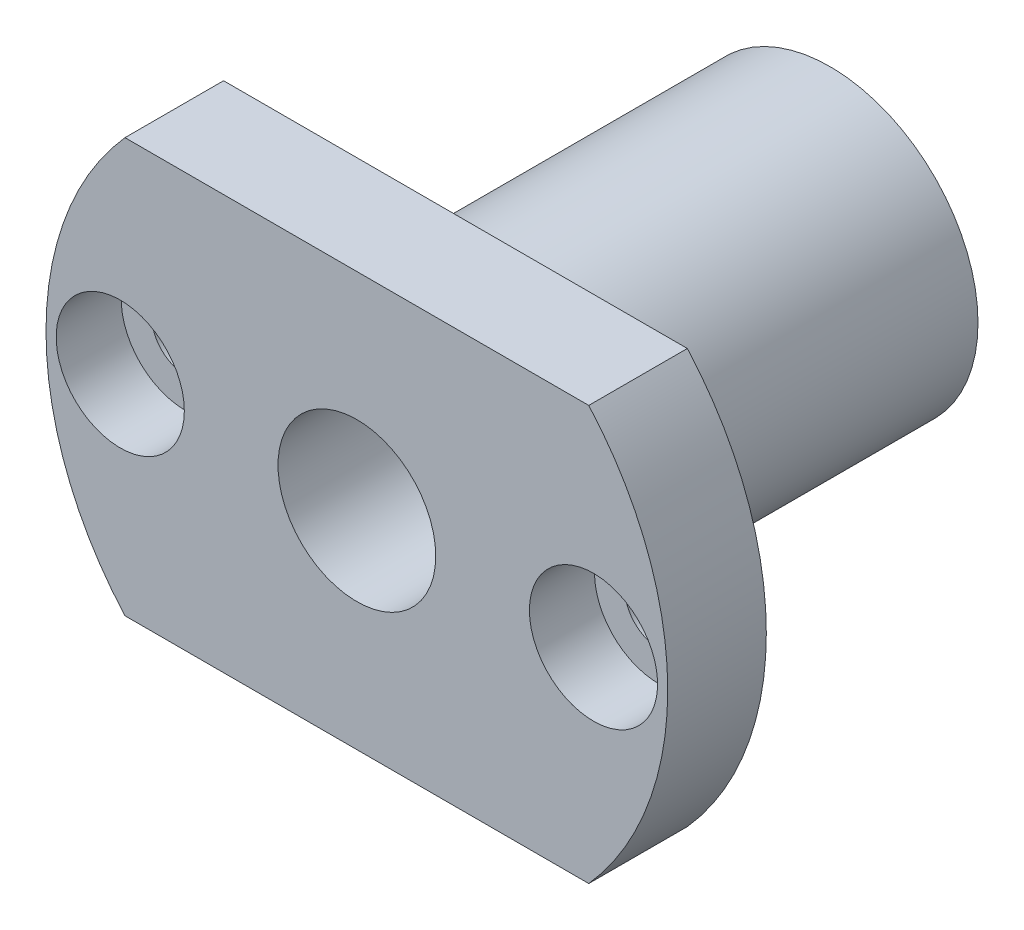
from build123d import *

# Parameters (mm, degrees)
SKETCH1_R           = 1.7
SKETCH1_R_2         = 4
BOSS_EXTRUDE1_DEPTH = 5
BOSS_EXTRUDE2_START = -19
SKETCH1_3_R         = 7.5
SKETCH1_3_R_2       = 4
BOSS_EXTRUDE2_DEPTH = 19
SKETCH2_R           = 3.25
CUT_EXTRUDE1_DEPTH  = 3.3


with BuildPart() as part:
    # Sketch1 → Boss-Extrude1 (new body)
    with BuildSketch(Plane.XY):
        with BuildLine():
            Line((11.760078621, 10.5), (-11.760078621, 10.5))
            ThreePointArc((-11.760078621, 10.5), (-15.765451125, 0), (-11.760078621, -10.5))
            Line((-11.760078621, -10.5), (11.760078621, -10.5))
            ThreePointArc((11.760078621, -10.5), (15.765451125, 0), (11.760078621, 10.5))
        make_face()
        with Locations((-12, 0)):
            Circle(SKETCH1_R, mode=Mode.SUBTRACT)
        with Locations((12, 0)):
            Circle(SKETCH1_R, mode=Mode.SUBTRACT)
        Circle(SKETCH1_R_2, mode=Mode.SUBTRACT)
    extrude(amount=BOSS_EXTRUDE1_DEPTH)

    # Sketch1<3> → Boss-Extrude2 (add)
    with BuildSketch(Plane.XY.offset(BOSS_EXTRUDE2_START)):
        Circle(SKETCH1_3_R)
        Circle(SKETCH1_3_R_2, mode=Mode.SUBTRACT)
    extrude(amount=BOSS_EXTRUDE2_DEPTH)

    # Sketch2 → Cut-Extrude1 (cut)
    with BuildSketch(Plane.XY.offset(5)):
        with Locations((-12, 0)):
            Circle(SKETCH2_R)
        with Locations((12, 0)):
            Circle(SKETCH2_R)
    extrude(amount=-CUT_EXTRUDE1_DEPTH, mode=Mode.SUBTRACT)


solid = part.part
